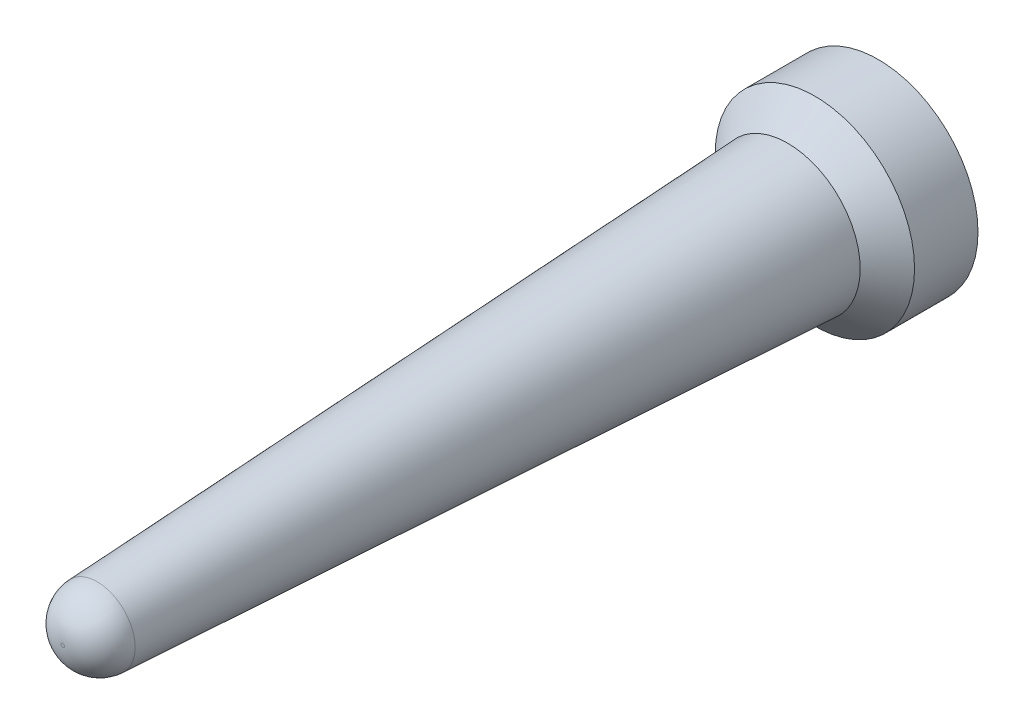
from build123d import *


with BuildPart() as part:
    # Sketch1 → Revolve1 (revolve)
    with BuildSketch(Plane(origin=(0, 0, 0), x_dir=(1, 0, 0), z_dir=(0, 1, 0))):
        with BuildLine():
            Line((0, 0), (0.2794, 0))
            Line((0.2794, 0), (0.2794, -0.1778))
            Line((0.2794, -0.1778), (0.2032, -0.254))
            Line((0.2032, -0.254), (0.106426317, -2.189473662))
            ThreePointArc((0.106426317, -2.189473662), (0.074978346, -2.258014007), (0.004953079, -2.286))
            Line((0.004953079, -2.286), (0, -2.286))
            Line((0, -2.286), (0, 0))
        make_face()
    revolve(axis=Axis((0, 0, 2.286), (0, 0, -1)))


solid = part.part
